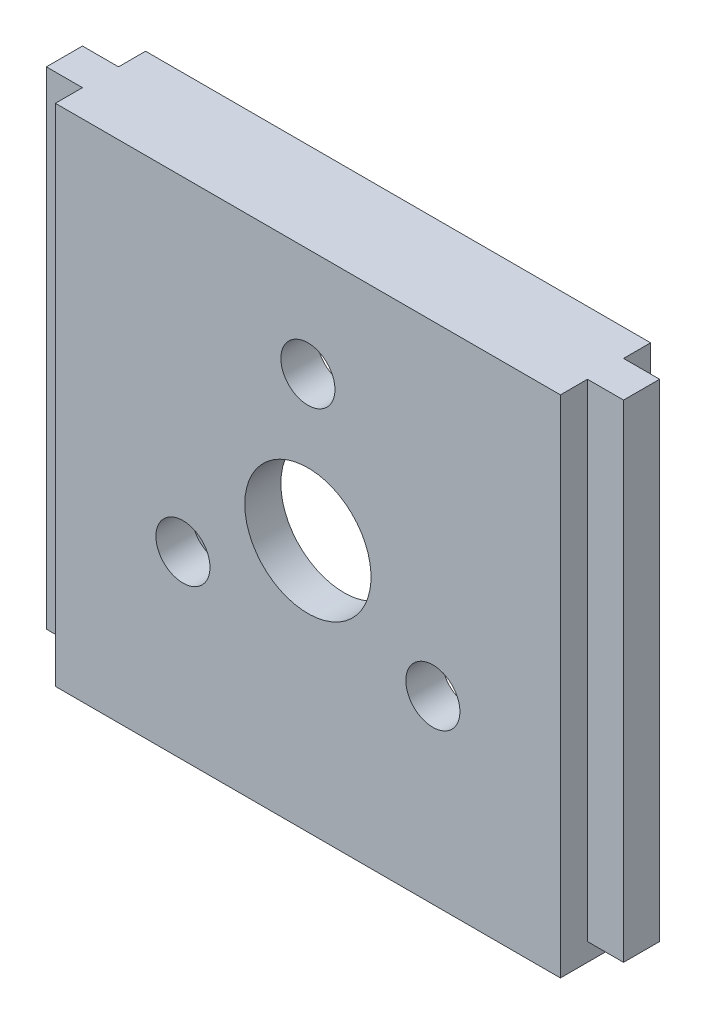
from build123d import *

# Parameters (mm, degrees)
ESQUISSE1_W                  = 28
ESQUISSE1_H                  = 28
BOSS_EXTRU_1_DEPTH           = 5
ENL_V_MAT_EXTRU_1_DEPTH      = 40.912404087
ENL_V_MAT_EXTRU_1_DEPTH_BACK = 40.912404087
ESQUISSE2_R                  = 3.5
ESQUISSE3_W                  = 2
ESQUISSE3_H                  = 2
BOSS_EXTRU_2_DEPTH           = 27
ESQUISSE5_R                  = 1.5
ENL_V_MAT_EXTRU_3_DEPTH      = 42.340053217
ESQUISSE6_R                  = 12.5
ENL_V_MAT_EXTRU_4_DEPTH      = 3


with BuildPart() as part:
    # Esquisse1 → Boss.-Extru.1 (new body)
    with BuildSketch(Plane.XY):
        with Locations((14, 14)):
            Rectangle(ESQUISSE1_W, ESQUISSE1_H)
    extrude(amount=BOSS_EXTRU_1_DEPTH)

    # Esquisse2 → Enlèv. mat.-Extru.1 (cut, two sides: drawn at the far end of the back side and taken through both)
    with BuildSketch(Plane.XY.offset(5).offset(-ENL_V_MAT_EXTRU_1_DEPTH_BACK)):
        with Locations((14, 14)):
            Circle(ESQUISSE2_R)
    extrude(amount=ENL_V_MAT_EXTRU_1_DEPTH + ENL_V_MAT_EXTRU_1_DEPTH_BACK, mode=Mode.SUBTRACT)

    # Esquisse3 → Boss.-Extru.2 (add)
    with BuildSketch(Plane(origin=(0, 28, 0), x_dir=(1, 0, 0), z_dir=(0, 1, 0))):
        with Locations((-1, -2.5)):
            Rectangle(ESQUISSE3_W, ESQUISSE3_H)
        with Locations((29, -2.5)):
            Rectangle(ESQUISSE3_W, ESQUISSE3_H)
    extrude(amount=-BOSS_EXTRU_2_DEPTH)

    # Esquisse5 → Enlèv. mat.-Extru.3 (cut, through all)
    with BuildSketch(Plane(origin=(0, 0, 0), x_dir=(-1, 0, 0), z_dir=(0, 0, -1))):
        with Locations((-14, 22)):
            Circle(ESQUISSE5_R)
        with Locations((-20.92820323, 10)):
            Circle(ESQUISSE5_R)
        with Locations((-7.07179677, 10)):
            Circle(ESQUISSE5_R)
    extrude(amount=-ENL_V_MAT_EXTRU_3_DEPTH, mode=Mode.SUBTRACT)

    # Esquisse6 → Enlèv. mat.-Extru.4 (cut)
    with BuildSketch(Plane(origin=(0, 0, 0), x_dir=(-1, 0, 0), z_dir=(0, 0, -1))):
        with Locations((-14, 14)):
            Circle(ESQUISSE6_R)
    extrude(amount=-ENL_V_MAT_EXTRU_4_DEPTH, mode=Mode.SUBTRACT)


solid = part.part
